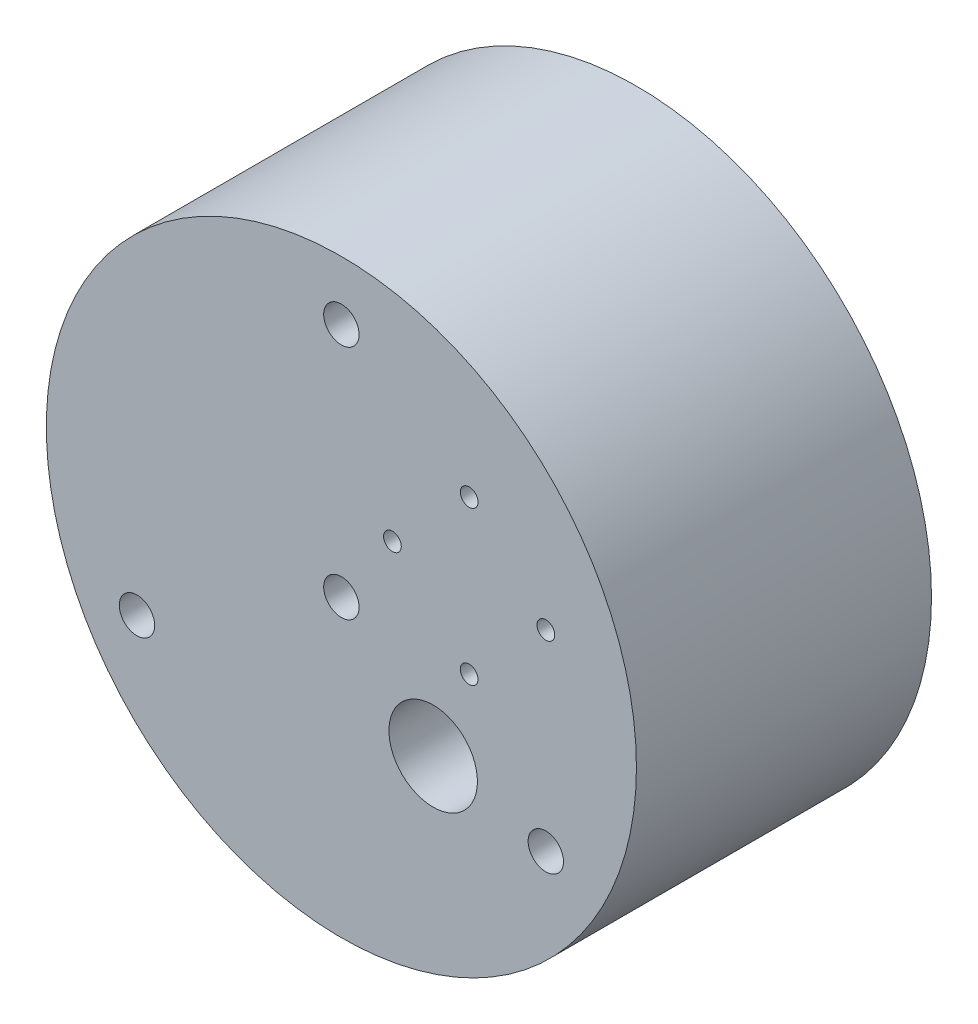
from build123d import *

# Parameters (mm, degrees)
SKETCH1_R           = 50
BOSS_EXTRUDE1_DEPTH = 50
SKETCH2_R           = 3
CUT_EXTRUDE1_DEPTH  = 87.602540378
SKETCH6_R           = 1.5
CUT_EXTRUDE2_DEPTH  = 10
SKETCH7_R           = 7.5
CUT_EXTRUDE3_DEPTH  = 87.602540378


with BuildPart() as part:
    # Sketch1 → Boss-Extrude1 (new body)
    with BuildSketch(Plane.XY):
        Circle(SKETCH1_R)
    extrude(amount=BOSS_EXTRUDE1_DEPTH)

    # Sketch2 → Cut-Extrude1 (cut, through all)
    with BuildSketch(Plane.XY.offset(50)):
        with Locations((0, 40)):
            Circle(SKETCH2_R)
        with Locations((34.641016151, -20)):
            Circle(SKETCH2_R)
        with Locations((-34.641016151, -20)):
            Circle(SKETCH2_R)
        Circle(SKETCH2_R)
    extrude(amount=-CUT_EXTRUDE1_DEPTH, mode=Mode.SUBTRACT)

    # Sketch6 → Cut-Extrude2 (cut)
    with BuildSketch(Plane.XY.offset(50)):
        with Locations((21.650635095, 25.5)):
            Circle(SKETCH6_R)
        with Locations((34.650635095, 12.5)):
            Circle(SKETCH6_R)
        with Locations((21.650635095, -0.5)):
            Circle(SKETCH6_R)
        with Locations((8.650635095, 12.5)):
            Circle(SKETCH6_R)
    extrude(amount=-CUT_EXTRUDE2_DEPTH, mode=Mode.SUBTRACT)

    # Sketch7 → Cut-Extrude3 (cut, through all)
    with BuildSketch(Plane.XY.offset(50)):
        with Locations((15.556349186, -15.556349186)):
            Circle(SKETCH7_R)
    extrude(amount=-CUT_EXTRUDE3_DEPTH, mode=Mode.SUBTRACT)


solid = part.part
